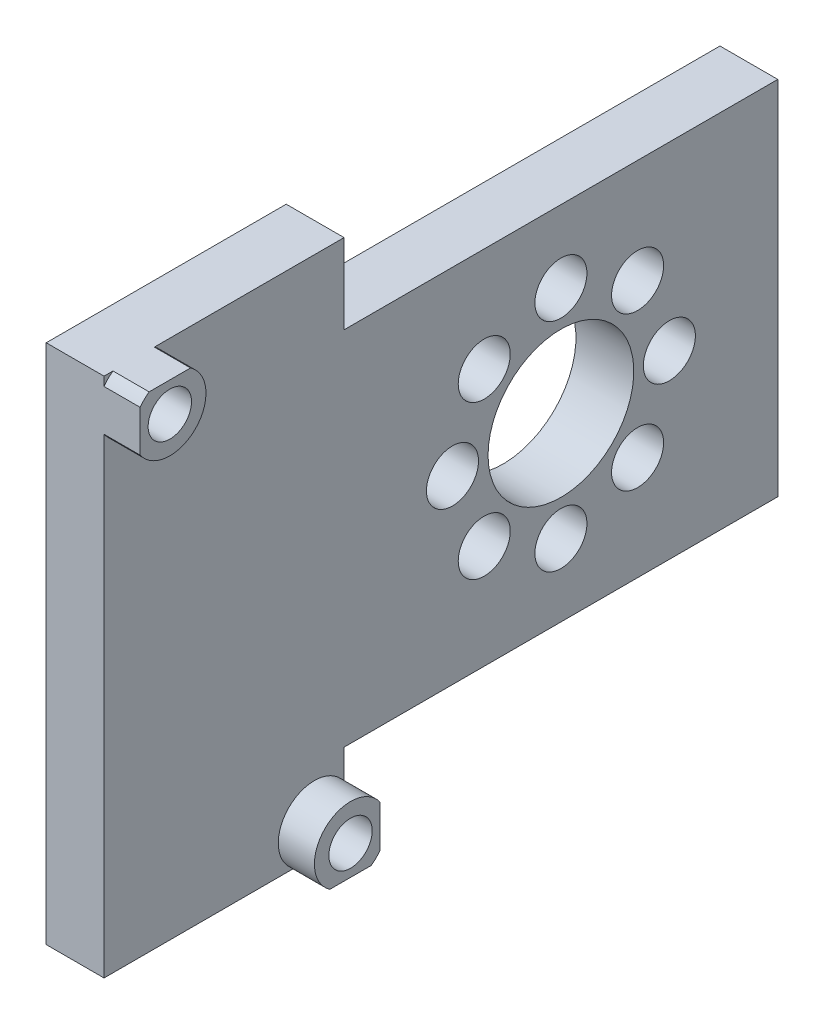
from build123d import *

# Parameters (mm, degrees)
SKETCH1_W           = 45.7835
SKETCH1_H           = 21.082
SKETCH1_R           = 1.905
BOSS_EXTRUDE1_DEPTH = 5.08
SKETCH2_R           = 1.905
BOSS_EXTRUDE2_DEPTH = 3.175
SKETCH4_W           = 31.75
SKETCH4_H           = 38.1
SKETCH4_R           = 6.4008
SKETCH4_R_2         = 2.286
BOSS_EXTRUDE4_DEPTH = 5.08


with BuildPart() as part:
    # Sketch1 → Boss-Extrude1 (new body)
    with BuildSketch(Plane.YZ):
        Rectangle(SKETCH1_W, SKETCH1_H)
        with Locations(Location((-20.28825, -7.9375, 0), (0, 0, 270))):
            Circle(SKETCH1_R, mode=Mode.SUBTRACT)
        with Locations(Location((20.28825, 7.9375, 0), (0, 0, 270))):
            Circle(SKETCH1_R, mode=Mode.SUBTRACT)
    extrude(amount=BOSS_EXTRUDE1_DEPTH)

    # Sketch2 → Boss-Extrude2 (add)
    # profile 1 of 2: a face of its own
    with BuildSketch(Plane.YZ.offset(5.08)):
        with BuildLine():
            Line((18.470995821, 10.541), (22.105504179, 10.541))
            ThreePointArc((22.105504179, 10.541), (22.53331403, 10.18256403), (22.89175, 9.754754179))
            Line((22.89175, 9.754754179), (22.89175, 6.120245821))
            ThreePointArc((22.89175, 6.120245821), (18.04318597, 5.69243597), (18.470995821, 10.541))
        make_face()
        with Locations(Location((20.28825, 7.9375, 0), (0, 0, 270))):
            Circle(SKETCH2_R, mode=Mode.SUBTRACT)
    # profile 2 of 2: a face of its own
    with BuildSketch(Plane.YZ.offset(5.08)):
        with BuildLine():
            Line((-22.89175, -6.120245821), (-22.89175, -9.754754179))
            ThreePointArc((-22.89175, -9.754754179), (-22.53331403, -10.18256403), (-22.105504179, -10.541))
            Line((-22.105504179, -10.541), (-18.470995821, -10.541))
            ThreePointArc((-18.470995821, -10.541), (-18.04318597, -5.69243597), (-22.89175, -6.120245821))
        make_face()
        with Locations(Location((-20.28825, -7.9375, 0), (0, 0, 270))):
            Circle(SKETCH2_R, mode=Mode.SUBTRACT)
    extrude(amount=BOSS_EXTRUDE2_DEPTH)

    # Sketch4 → Boss-Extrude4 (add)
    with BuildSketch(Plane(origin=(0, 0, 0), x_dir=(0, -1, 0), z_dir=(-1, 0, 0))):
        with Locations((0, -29.591)):
            Rectangle(SKETCH4_W, SKETCH4_H)
        with Locations(Location((0, -29.591, 0), (0, 0, 90))):
            Circle(SKETCH4_R, mode=Mode.SUBTRACT)
        with Locations(Location((0, -20.066, 0), (0, 0, 90))):
            Circle(SKETCH4_R_2, mode=Mode.SUBTRACT)
        with Locations(Location((6.735192091, -22.855807909, 0), (0, 0, 90))):
            Circle(SKETCH4_R_2, mode=Mode.SUBTRACT)
        with Locations(Location((9.525, -29.591, 0), (0, 0, 90))):
            Circle(SKETCH4_R_2, mode=Mode.SUBTRACT)
        with Locations(Location((6.735192091, -36.326192091, 0), (0, 0, 90))):
            Circle(SKETCH4_R_2, mode=Mode.SUBTRACT)
        with Locations(Location((0, -39.116, 0), (0, 0, 90))):
            Circle(SKETCH4_R_2, mode=Mode.SUBTRACT)
        with Locations(Location((-6.735192091, -36.326192091, 0), (0, 0, 90))):
            Circle(SKETCH4_R_2, mode=Mode.SUBTRACT)
        with Locations(Location((-9.525, -29.591, 0), (0, 0, 90))):
            Circle(SKETCH4_R_2, mode=Mode.SUBTRACT)
        with Locations(Location((-6.735192091, -22.855807909, 0), (0, 0, 90))):
            Circle(SKETCH4_R_2, mode=Mode.SUBTRACT)
    extrude(amount=-BOSS_EXTRUDE4_DEPTH)


solid = part.part
